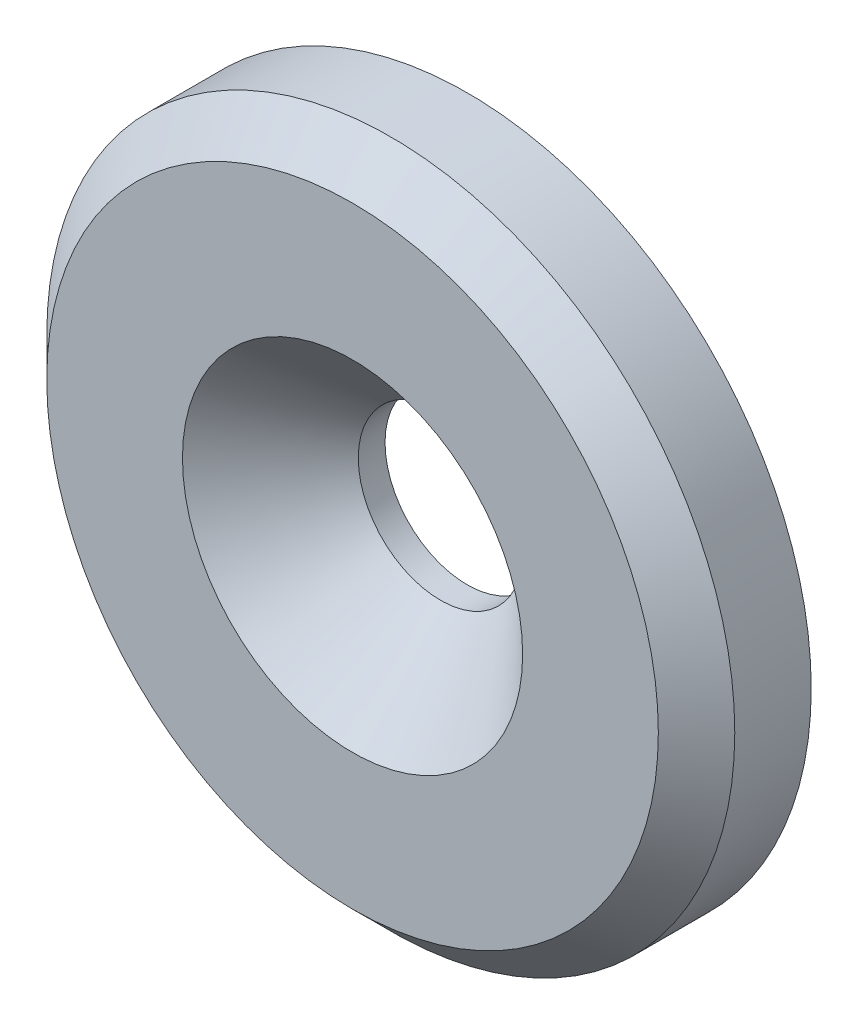
from build123d import *

# Parameters (mm, degrees)
SZKIC1_W                    = 9
SZKIC1_H                    = 3
SZKIC4_R                    = 6.75
DODANIE_WYCI_GNI_CIE1_DEPTH = 4.5


with BuildPart() as part:
    # Szkic1 → Obrót1 (revolve)
    with BuildSketch(Plane(origin=(0, 0, 0), x_dir=(1, 0, 0), z_dir=(0, 1, 0)), mode=Mode.PRIVATE) as obr_t1_sk:
        with Locations((4.5, -1.5)):
            Rectangle(SZKIC1_W, SZKIC1_H)
    revolve(obr_t1_sk.sketch.rotate(Axis((0, 0, 3), (0, 0, -1)), 180), axis=Axis((0, 0, 3), (0, 0, -1)))

    # Szkic2 → Wycięcie-obrót1 (revolve, cut)
    with BuildSketch(Plane(origin=(0, 0, 0), x_dir=(1, 0, 0), z_dir=(0, 1, 0)), mode=Mode.PRIVATE) as wyci_cie_obr_t1_sk:
        Polygon((8, -3), (9, -3), (9, -2), align=None)
    revolve(wyci_cie_obr_t1_sk.sketch.rotate(Axis((0, 0, 3), (0, 0, -1)), 180), axis=Axis((0, 0, 3), (0, 0, -1)), mode=Mode.SUBTRACT)

    # Szkic3 → Wycięcie-obrót2 (revolve, cut)
    with BuildSketch(Plane(origin=(0, 0, 0), x_dir=(1, 0, 0), z_dir=(0, 1, 0)), mode=Mode.PRIVATE) as wyci_cie_obr_t2_sk:
        Polygon((0, 0), (2.15, 0), (2.15, -0.7), (4.45, -3), (0, -3), align=None)
    revolve(wyci_cie_obr_t2_sk.sketch.rotate(Axis((0, 0, 3), (0, 0, -1)), 180), axis=Axis((0, 0, 3), (0, 0, -1)), mode=Mode.SUBTRACT)


with BuildPart() as body_2:
    # Szkic4 → Dodanie-wyciągnięcie1 (new body)
    with BuildSketch(Plane(origin=(0, 0, 0), x_dir=(0, 0, -1), z_dir=(1, 0, 0))):
        Circle(SZKIC4_R)
    extrude(amount=DODANIE_WYCI_GNI_CIE1_DEPTH)

    # Usuń ścianę1: 1 face struck out; the rest of the skin is kept as a surface, the solid goes
    usu_cian_1_1_drop = [body_2.part.faces().sort_by_distance(Vector(p))[0] for p in ((4.5, 0, 0),)]
    usu_cian_1_1 = Shell(body_2.part.faces() - usu_cian_1_1_drop)


solid = part.part
